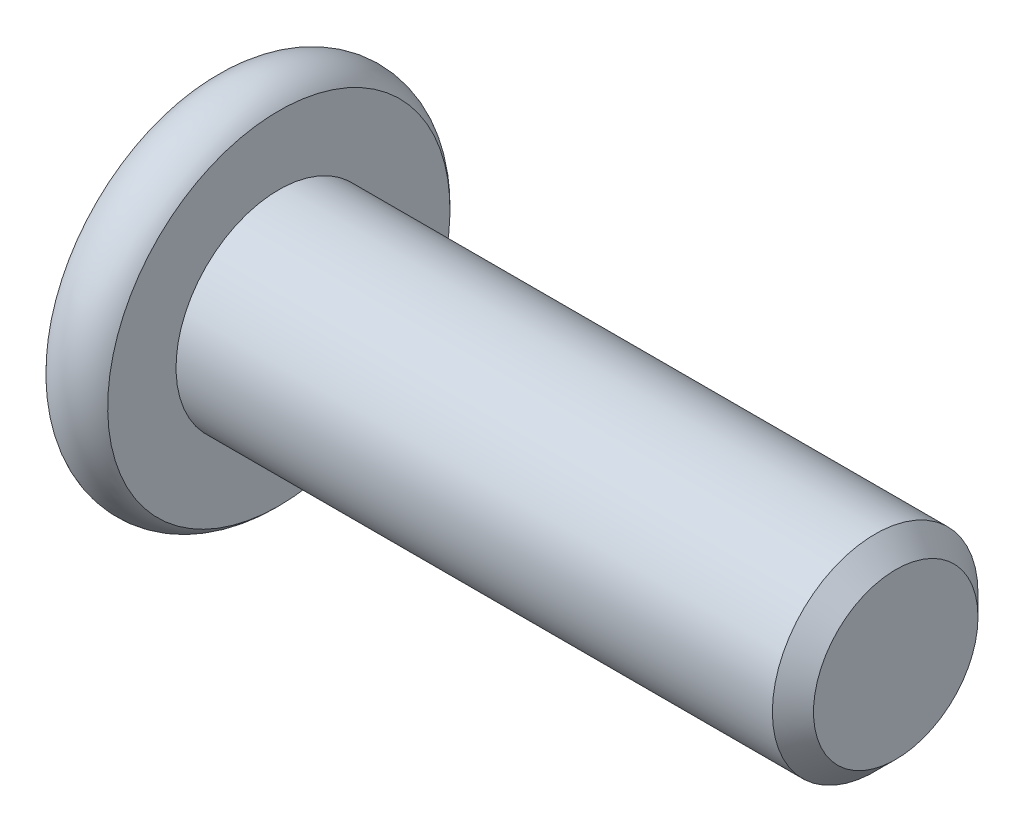
from build123d import *

# Parameters (mm, degrees)
SKETCH2_R           = 2.5
BOSS_EXTRUDE1_DEPTH = 15
CHAMFER1_SIZE       = 0.5
CUT_EXTRUDE1_DEPTH  = 2.3
SKETCH8_R           = 1.782050808
CUT_EXTRUDE2_DEPTH  = 1
CUT_EXTRUDE2_DRAFT  = -45


with BuildPart() as part:
    # Sketch2 → Boss-Extrude1 (new body)
    with BuildSketch(Plane(origin=(0, 0, 0), x_dir=(0, 0, -1), z_dir=(1, 0, 0))):
        Circle(SKETCH2_R)
    extrude(amount=-BOSS_EXTRUDE1_DEPTH)

    # Chamfer1
    chamfer1_edges = [part.edges().sort_by_distance(p)[0] for p in [
        (0, 0, 2.5),
    ]]
    chamfer(chamfer1_edges, length=CHAMFER1_SIZE)

    # Sketch6 → Revolve1 (revolve)
    with BuildSketch(Plane.XY, mode=Mode.PRIVATE) as revolve1_sk:
        with BuildLine():
            Line((-16.5, 0), (-16.5, 4.161437828))
            ThreePointArc((-16.5, 4.161437828), (-15.75, 4.5), (-15, 4.161437828))
            Line((-15, 4.161437828), (-15, 0))
            Line((-15, 0), (-16.5, 0))
        make_face()
    revolve(revolve1_sk.sketch.rotate(Axis((-15, 0, 0), (1, 0, 0)), 180), axis=Axis((-15, 0, 0), (1, 0, 0)))

    # Sketch7 → Cut-Extrude1 (cut)
    with BuildSketch(Plane.ZY.offset(16.5)):
        Polygon((0, 1.732050808), (-1.5, 0.866025404), (-1.5, -0.866025404), (0, -1.732050808), (1.5, -0.866025404), (1.5, 0.866025404), align=None)
    extrude(amount=-CUT_EXTRUDE1_DEPTH, mode=Mode.SUBTRACT)


with BuildPart() as cut_extrude2_tool:
    # Sketch8 → Cut-Extrude2 (with draft: the straight prism first)
    with BuildSketch(Plane.ZY.offset(16.5)):
        Circle(SKETCH8_R)
    extrude(amount=-CUT_EXTRUDE2_DEPTH)
    # Cut-Extrude2: the draft: its side faces are tilted about the plane it starts from
    cut_extrude2_sides = [cut_extrude2_tool.faces().sort_by_distance(p)[0] for p in [
        (-16, 0, -1.782050808),
    ]]
    draft(cut_extrude2_sides, Plane.ZY.offset(16.5), CUT_EXTRUDE2_DRAFT)


with BuildPart() as part_1:
    add(part.part)

    # Cut-Extrude2: cut by cut_extrude2_tool
    add(cut_extrude2_tool.part, mode=Mode.SUBTRACT)


solid = part_1.part
